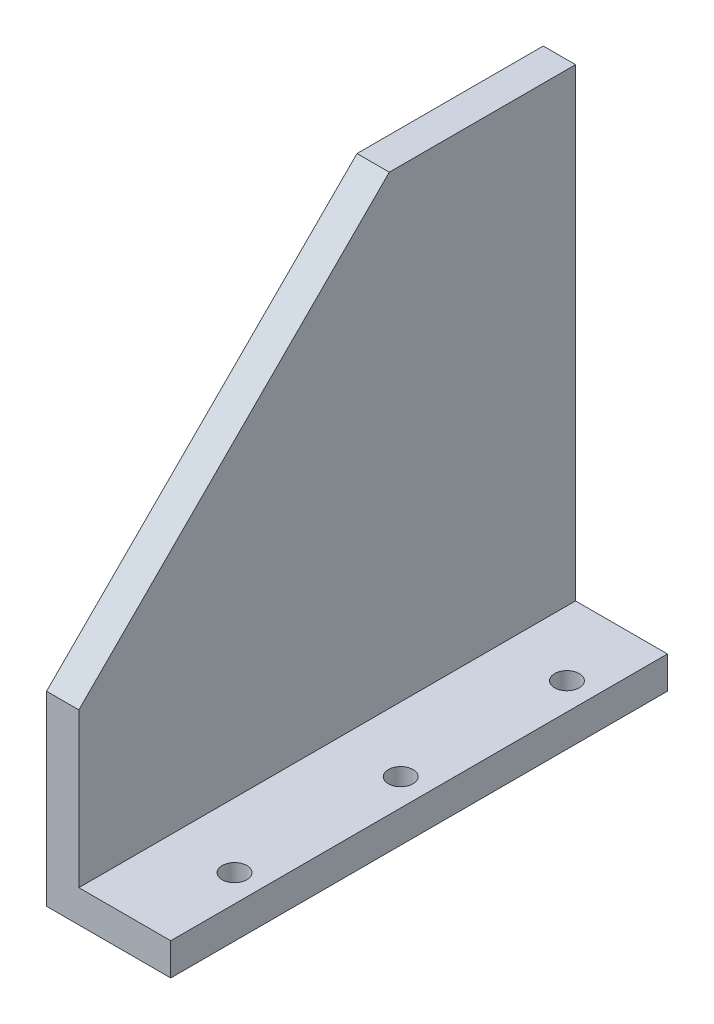
from build123d import *

# Parameters (mm, degrees)
BOSS_EXTRUDE1_DEPTH          = 50.8
F_39_0_0995_DIAMETER_HOLE1_D = 2.5273
CUT_EXTRUDE1_DEPTH           = 3.302


with BuildPart() as part:
    # Sketch4 → Boss-Extrude1 (new body)
    with BuildSketch(Plane.XY):
        Polygon((0, 0), (0, 50.8), (3.302, 50.8), (3.302, 3.302), (12.7, 3.302), (12.7, 0), align=None)
    extrude(amount=BOSS_EXTRUDE1_DEPTH)

    # #39 (0.0995) Diameter Hole1 (through all)
    with Locations(Plane(origin=(0, 0, 0), x_dir=(-1, 0, 0), z_dir=(0, -1, 0))):
        with Locations((-9.929634817, -7.507852782), (-9.929634817, -24.510629703), (-9.929634817, -41.507852782)):
            Hole(F_39_0_0995_DIAMETER_HOLE1_D / 2)

    # Sketch7 → Cut-Extrude1 (cut)
    with BuildSketch(Plane.ZY):
        Polygon((50.8, 50.8), (19.05, 50.8), (50.8, 19.05), align=None)
    extrude(amount=-CUT_EXTRUDE1_DEPTH, mode=Mode.SUBTRACT)


solid = part.part
